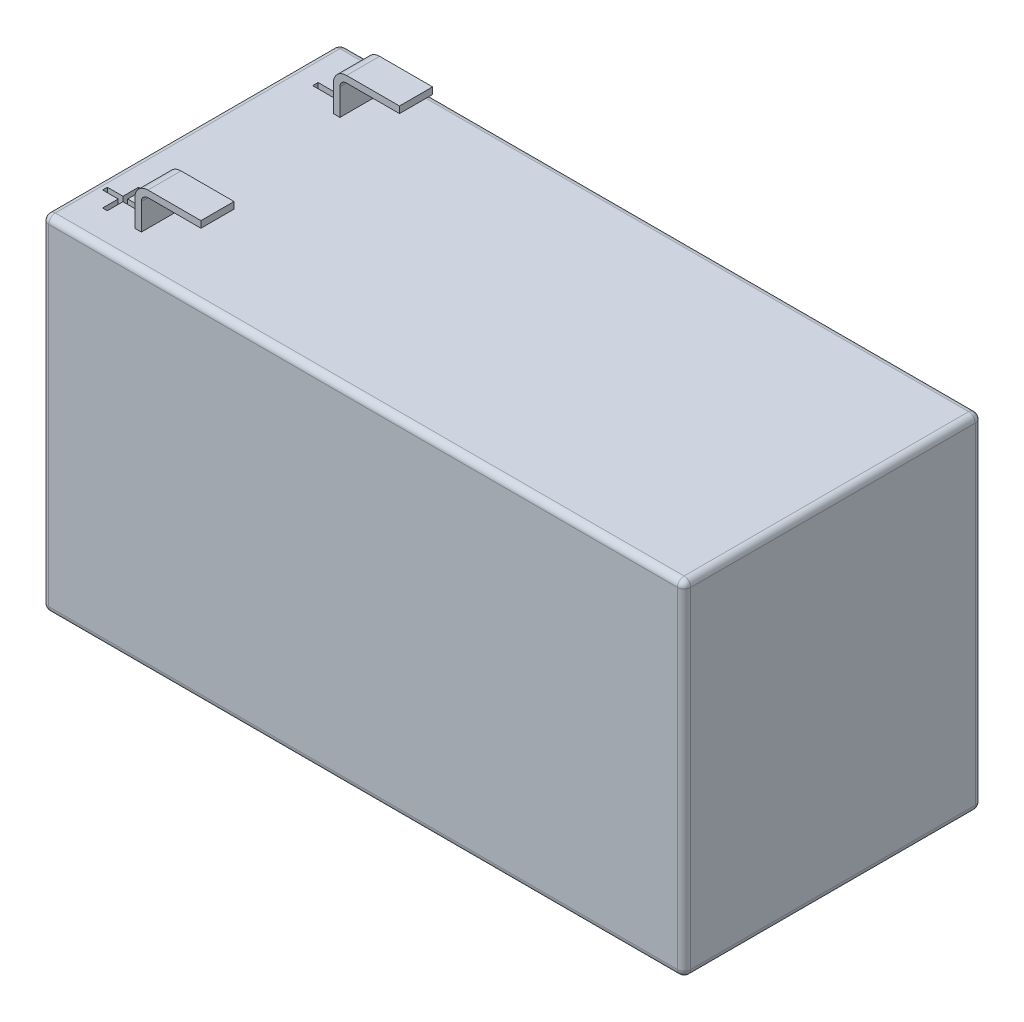
from build123d import *

# Parameters (mm, degrees)
SCHIZZO1_W               = 97
SCHIZZO1_H               = 52
ESTRUSIONE1_DEPTH        = 22.5
RACCORDO1_R              = 1
ESTRUSIONE2_DEPTH        = 17.5
SCHIZZO4_W               = 33.983715523
SCHIZZO4_H               = 25
TAGLIO_ESTRUSIONE2_DEPTH = 35
SCHIZZO5_W               = 3.076923077
SCHIZZO5_H               = 0.820512821
TAGLIO_ESTRUSIONE3_DEPTH = 5


with BuildPart() as part:
    # Schizzo1 → Estrusione1 (new, symmetric)
    with BuildSketch(Plane.XY):
        with Locations((0, 26)):
            Rectangle(SCHIZZO1_W, SCHIZZO1_H)
    extrude(amount=ESTRUSIONE1_DEPTH, both=True)

    # Raccordo1
    raccordo1_edges = [part.edges().sort_by_distance(p)[0] for p in [
        (48.5, 26, 22.5),
        (0, 52, 22.5),
        (-48.5, 26, 22.5),
        (0, 52, -22.5),
        (48.5, 26, -22.5),
        (0, 0, -22.5),
        (-48.5, 26, -22.5),
        (0, 0, 22.5),
        (-48.5, 52, 0),
        (48.5, 52, 0),
        (48.5, 0, 0),
        (-48.5, 0, 0),
    ]]
    fillet(raccordo1_edges, radius=RACCORDO1_R)

    # Schizzo3 → Estrusione2 (add, symmetric)
    with BuildSketch(Plane.XY):
        with BuildLine():
            Line((-38.5, 52), (-38.5, 56))
            ThreePointArc((-38.5, 56), (-38.207106781, 56.707106781), (-37.5, 57))
            Line((-37.5, 57), (-29.5, 57))
            Line((-29.5, 57), (-29.5, 58))
            Line((-29.5, 58), (-37.5, 58))
            ThreePointArc((-37.5, 58), (-38.914213562, 57.414213562), (-39.5, 56))
            Line((-39.5, 56), (-39.5, 52))
            Line((-39.5, 52), (-38.5, 52))
        make_face()
    extrude(amount=ESTRUSIONE2_DEPTH, both=True)

    # Schizzo4 → Taglio-Estrusione2 (cut)
    with BuildSketch(Plane(origin=(0, 52, 0), x_dir=(-1, 0, 0), z_dir=(0, 1, 0))):
        with Locations((27.266516562, 0)):
            Rectangle(SCHIZZO4_W, SCHIZZO4_H)
    extrude(amount=TAGLIO_ESTRUSIONE2_DEPTH, mode=Mode.SUBTRACT)

    # Schizzo5 → Taglio-Estrusione3 (cut)
    with BuildSketch(Plane(origin=(0, 52, 0), x_dir=(-1, 0, 0), z_dir=(0, 1, 0))):
        Polygon((43.863317921, 14.922376349), (43.863317921, 17.281350708), (44.581266639, 17.281350708), (44.581266639, 14.922376349), (46.940240998, 14.922376349), (46.940240998, 14.204427631), (44.581266639, 14.204427631), (44.581266639, 11.845453272), (43.863317921, 11.845453272), (43.863317921, 14.204427631), (41.504343562, 14.204427631), (41.504343562, 14.922376349), align=None)
        with Locations((43.183620569, -15.012890571)):
            Rectangle(SCHIZZO5_W, SCHIZZO5_H)
    extrude(amount=-TAGLIO_ESTRUSIONE3_DEPTH, mode=Mode.SUBTRACT)


solid = part.part
